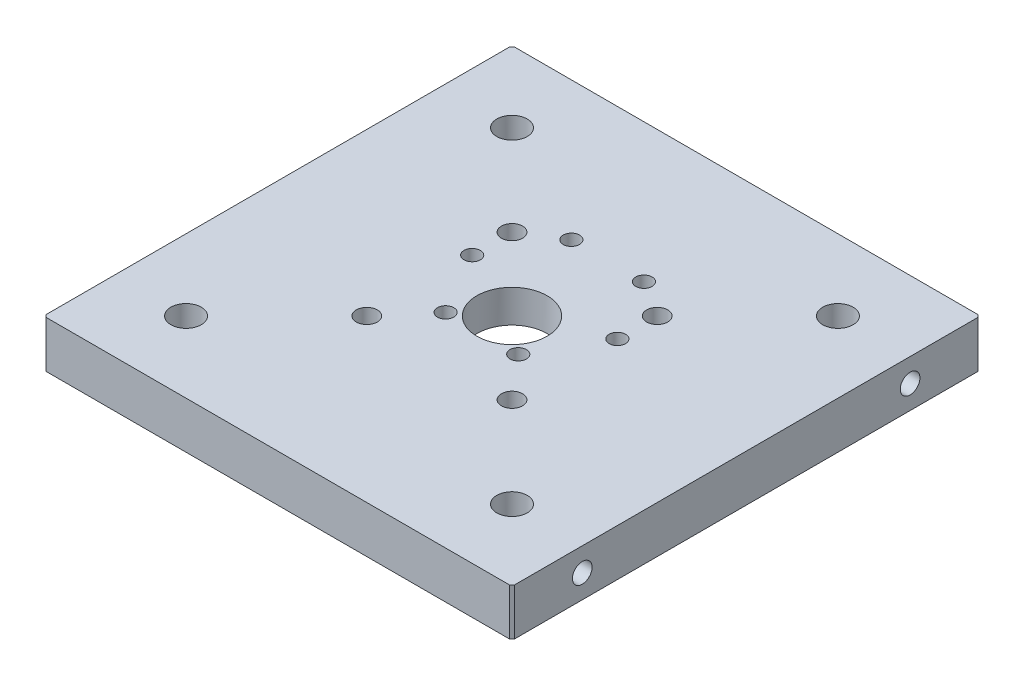
from build123d import *

# Parameters (mm, degrees)
BOSS_EXTRUDE1_DEPTH                  = 5
BOSS_EXTRUDE1_DEPTH_BACK             = 5
SKETCH1_W                            = 100
SKETCH1_H                            = 100
SKETCH2_R                            = 7.5
SKETCH2_R_2                          = 3.25
CUT_EXTRUDE1_DEPTH                   = 12.7
TAP_DRILL_FOR_M5X0_8_TAP1_AT_2_COUNT = 2
TAP_DRILL_FOR_M5X0_8_TAP1_AT_2_PITCH = 70
SKETCH11_R                           = 37.5
CUT_EXTRUDE2_DEPTH                   = 3
CHAMFER1_SIZE                        = 0.5
SKETCH12_R                           = 1.75
CUT_EXTRUDE3_DEPTH                   = 72.414284285
SKETCH13_R                           = 2.25
CUT_EXTRUDE4_DEPTH                   = 10


with BuildPart() as part:
    # Sketch1 → Boss-Extrude1 (new, two sides: drawn at the far end of the back side and taken through both)
    with BuildSketch(Plane(origin=(0, 0, 0), x_dir=(1, 0, 0), z_dir=(0, 1, 0)).offset(-BOSS_EXTRUDE1_DEPTH_BACK)):
        Rectangle(SKETCH1_W, SKETCH1_H)
    extrude(amount=BOSS_EXTRUDE1_DEPTH + BOSS_EXTRUDE1_DEPTH_BACK)

    # Sketch2 → Cut-Extrude1 (cut)
    with BuildSketch(Plane(origin=(0, 5, 0), x_dir=(1, 0, 0), z_dir=(0, 1, 0))):
        Circle(SKETCH2_R)
        with Locations((-34.798492469, 34.798492469)):
            Circle(SKETCH2_R_2)
        with Locations((34.798492469, 34.798492469)):
            Circle(SKETCH2_R_2)
        with Locations((34.798492469, -34.798492469)):
            Circle(SKETCH2_R_2)
        with Locations((-34.798492469, -34.798492469)):
            Circle(SKETCH2_R_2)
    extrude(amount=-CUT_EXTRUDE1_DEPTH, mode=Mode.SUBTRACT)

    # Sketch10 → Tap Drill for M5x0.8 Tap1 (revolve, cut)
    with BuildSketch(Plane(origin=(-50, 0, -35), x_dir=(0, 0, 1), z_dir=(0, 1, 0))):
        Polygon((0, 0), (0, 11.2618073), (2.1, 10), (2.1, 0), align=None)
    tap_drill_for_m5x0_8_tap1 = revolve(axis=Axis((-56.35, 0, -35), (1, 0, 0)), mode=Mode.SUBTRACT)

    # Tap Drill for M5x0.8 Tap1 at 2: Tap Drill for M5x0.8 Tap1 ×2
    with Locations(*[(0, 0, i * TAP_DRILL_FOR_M5X0_8_TAP1_AT_2_PITCH) for i in range(1, TAP_DRILL_FOR_M5X0_8_TAP1_AT_2_COUNT)]):
        add(tap_drill_for_m5x0_8_tap1, mode=Mode.SUBTRACT)

    # Sketch11 → Cut-Extrude2 (cut)
    with BuildSketch(Plane.XZ.offset(5)):
        Circle(SKETCH11_R)
    extrude(amount=-CUT_EXTRUDE2_DEPTH, mode=Mode.SUBTRACT)

    # Chamfer1
    chamfer1_edges = [part.edges().sort_by_distance(p)[0] for p in [
        (50, 0, -50),
        (50, 0, 50),
        (-50, 0, 50),
        (-50, 0, -50),
    ]]
    chamfer(chamfer1_edges, length=CHAMFER1_SIZE)

    # Mirror1: Tap Drill for M5x0.8 Tap1 across plane
    add(tap_drill_for_m5x0_8_tap1.mirror(Plane.ZY), mode=Mode.SUBTRACT)

    # Mirror1 copy 1 sketch → Mirror1 copy 1 (revolve, cut)
    with BuildSketch(Plane(origin=(50, 0, 35), x_dir=(0, 0, 1), z_dir=(0, 1, 0))):
        Polygon((0, 0), (0, -11.2618073), (2.1, -10), (2.1, 0), align=None)
    revolve(axis=Axis((56.35, 0, 35), (1, 0, 0)), mode=Mode.SUBTRACT)

    # Sketch12 → Cut-Extrude3 (cut, through all)
    with BuildSketch(Plane(origin=(0, 5, 0), x_dir=(1, 0, 0), z_dir=(0, 1, 0))):
        with Locations((-15.5, 7)):
            Circle(SKETCH12_R)
        with Locations((15.5, 7)):
            Circle(SKETCH12_R)
        with Locations((-7.75, 20.423393759)):
            Circle(SKETCH12_R)
        with Locations((7.75, 20.423393759)):
            Circle(SKETCH12_R)
        with Locations((7.75, -6.423393759)):
            Circle(SKETCH12_R)
        with Locations((-7.75, -6.423393759)):
            Circle(SKETCH12_R)
    extrude(amount=-CUT_EXTRUDE3_DEPTH, mode=Mode.SUBTRACT)

    # Sketch13 → Cut-Extrude4 (cut)
    with BuildSketch(Plane(origin=(0, 5, 0), x_dir=(1, 0, 0), z_dir=(0, 1, 0))):
        with Locations((-15.5, -15.5)):
            Circle(SKETCH13_R)
        with Locations((-15.5, 15.5)):
            Circle(SKETCH13_R)
        with Locations((15.5, 15.5)):
            Circle(SKETCH13_R)
        with Locations((15.5, -15.5)):
            Circle(SKETCH13_R)
    extrude(amount=-CUT_EXTRUDE4_DEPTH, mode=Mode.SUBTRACT)


solid = part.part
